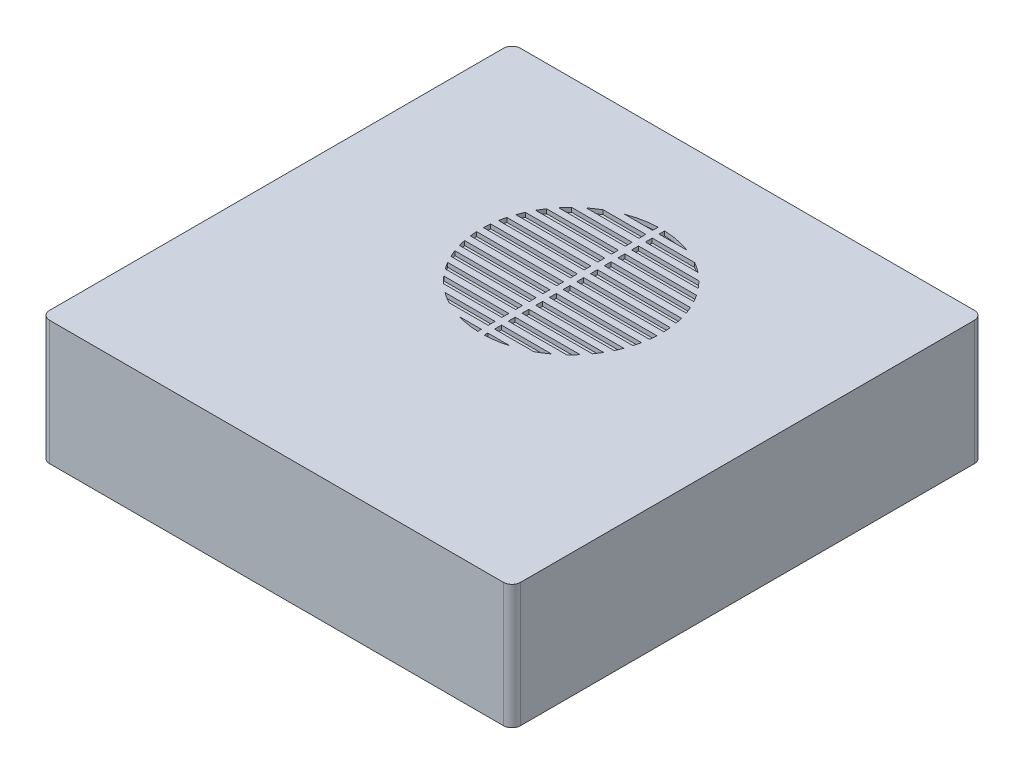
from build123d import *

# Parameters (mm, degrees)
SKETCH_1_W          = 110
SKETCH_1_H          = 110
EXTRUDE_1_DEPTH     = 29
CUT_EXTRUDE_1_DEPTH = 7
SKETCH_3_W          = 53.883979218
SKETCH_3_H          = 56.07244117
CUT_EXTRUDE_3_DEPTH = 6
SKETCH_4_W          = 10.323301276
SKETCH_4_H          = 3.598949069
SKETCH_4_W_2        = 10.796847207
SKETCH_4_W_3        = 11.270393137
SKETCH_4_W_4        = 49.154067547
SKETCH_4_H_2        = 7.671444068
CUT_EXTRUDE_4_DEPTH = 10
FILLET_1_R          = 2


with BuildPart() as part:
    # 草图1 → 凸台-拉伸1 (new body)
    with BuildSketch(Plane(origin=(0, 0, 0), x_dir=(1, 0, 0), z_dir=(0, 1, 0))):
        Rectangle(SKETCH_1_W, SKETCH_1_H)
    extrude(amount=EXTRUDE_1_DEPTH)

    # 草图2 → 切除-拉伸1 (cut)
    with BuildSketch(Plane(origin=(0, 29, 0), x_dir=(1, 0, 0), z_dir=(0, 1, 0))):
        with BuildLine():
            Line((-0.751901528, 34.886318516), (-0.751901528, 33.59149031))
            Line((-0.751901528, 33.59149031), (-7.310776634, 33.59149031))
            ThreePointArc((-7.310776634, 33.59149031), (-4.082993976, 34.500559204), (-0.751901528, 34.886318516))
        make_face()
        with BuildLine():
            Line((-0.751901528, 31.99149031), (-0.751901528, 30.39149031))
            Line((-0.751901528, 30.39149031), (-13.029015886, 30.39149031))
            ThreePointArc((-13.029015886, 30.39149031), (-11.883781834, 31.230990299), (-10.684631719, 31.99149031))
            Line((-10.684631719, 31.99149031), (-0.751901528, 31.99149031))
        make_face()
        with BuildLine():
            Line((0.751901528, 34.886318516), (0.751901528, 33.59149031))
            Line((0.751901528, 33.59149031), (7.310776634, 33.59149031))
            ThreePointArc((7.310776634, 33.59149031), (4.082993976, 34.500559204), (0.751901528, 34.886318516))
        make_face()
        with BuildLine():
            Line((-14.840119775, 28.79149031), (-0.751901528, 28.79149031))
            Line((-0.751901528, 28.79149031), (-0.751901528, 27.19149031))
            Line((-0.751901528, 27.19149031), (-16.296719146, 27.19149031))
            ThreePointArc((-16.296719146, 27.19149031), (-15.588960341, 28.010190206), (-14.840119775, 28.79149031))
        make_face()
        with BuildLine():
            Line((-17.487622906, 25.59149031), (-0.751901528, 25.59149031))
            Line((-0.751901528, 25.59149031), (-0.751901528, 23.99149031))
            Line((-0.751901528, 23.99149031), (-18.464313009, 23.99149031))
            ThreePointArc((-18.464313009, 23.99149031), (-17.993760697, 24.802351555), (-17.487622906, 25.59149031))
        make_face()
        with BuildLine():
            Line((-19.259406919, 22.39149031), (-0.751901528, 22.39149031))
            Line((-0.751901528, 22.39149031), (-0.751901528, 20.79149031))
            Line((-0.751901528, 20.79149031), (-19.894689112, 20.79149031))
            ThreePointArc((-19.894689112, 20.79149031), (-19.593386869, 21.597977674), (-19.259406919, 22.39149031))
        make_face()
        with BuildLine():
            Line((-20.385106201, 19.19149031), (-0.751901528, 19.19149031))
            Line((-0.751901528, 19.19149031), (-0.751901528, 17.59149031))
            Line((-0.751901528, 17.59149031), (-20.740936691, 17.59149031))
            ThreePointArc((-20.740936691, 17.59149031), (-20.578577477, 18.394949879), (-20.385106201, 19.19149031))
        make_face()
        with BuildLine():
            Line((-20.969033235, 15.99149031), (-0.751901528, 15.99149031))
            Line((-0.751901528, 15.99149031), (-0.751901528, 14.39149031))
            Line((-0.751901528, 14.39149031), (-21.073543954, 14.39149031))
            ThreePointArc((-21.073543954, 14.39149031), (-21.03650575, 15.192484283), (-20.969033235, 15.99149031))
        make_face()
        with BuildLine():
            Line((-21.056309144, 12.79149031), (-0.751901528, 12.79149031))
            Line((-0.751901528, 12.79149031), (-0.751901528, 11.19149031))
            Line((-0.751901528, 11.19149031), (-20.917027866, 11.19149031))
            ThreePointArc((-20.917027866, 11.19149031), (-21.001910745, 11.990163461), (-21.056309144, 12.79149031))
        make_face()
        with BuildLine():
            Line((-20.653231097, 9.59149031), (-0.751901528, 9.59149031))
            Line((-0.751901528, 9.59149031), (-0.751901528, 7.99149031))
            Line((-0.751901528, 7.99149031), (-20.260055644, 7.99149031))
            ThreePointArc((-20.260055644, 7.99149031), (-20.472280234, 8.787647791), (-20.653231097, 9.59149031))
        make_face()
        with BuildLine():
            Line((-19.729768237, 6.39149031), (-0.751901528, 6.39149031))
            Line((-0.751901528, 6.39149031), (-0.751901528, 4.79149031))
            Line((-0.751901528, 4.79149031), (-19.050922672, 4.79149031))
            ThreePointArc((-19.050922672, 4.79149031), (-19.406841496, 5.584491395), (-19.729768237, 6.39149031))
        make_face()
        with BuildLine():
            Line((-18.206909531, 3.19149031), (-0.751901528, 3.19149031))
            Line((-0.751901528, 3.19149031), (-0.751901528, 1.59149031))
            Line((-0.751901528, 1.59149031), (-17.173393801, 1.59149031))
            ThreePointArc((-17.173393801, 1.59149031), (-17.708231587, 2.379811633), (-18.206909531, 3.19149031))
        make_face()
        with BuildLine():
            Line((-15.91349599, -0.00850969), (-0.751901528, -0.00850969))
            Line((-0.751901528, -0.00850969), (-0.751901528, -1.60850969))
            Line((-0.751901528, -1.60850969), (-14.367785306, -1.60850969))
            ThreePointArc((-14.367785306, -1.60850969), (-15.161761086, -0.828913494), (-15.91349599, -0.00850969))
        make_face()
        with BuildLine():
            Line((-12.430090691, -3.20850969), (-0.751901528, -3.20850969))
            Line((-0.751901528, -3.20850969), (-0.751901528, -4.80850969))
            Line((-0.751901528, -4.80850969), (-9.872236553, -4.80850969))
            ThreePointArc((-9.872236553, -4.80850969), (-11.17982335, -4.054326816), (-12.430090691, -3.20850969))
        make_face()
        with BuildLine():
            Line((-5.940955693, -6.40850969), (-0.751901528, -6.40850969))
            Line((-0.751901528, -6.40850969), (-0.751901528, -7.249525385))
            ThreePointArc((-0.751901528, -7.249525385), (-3.372745364, -6.991391514), (-5.940955693, -6.40850969))
        make_face()
        with BuildLine():
            Line((0.751901528, 31.99149031), (0.751901528, 30.39149031))
            Line((0.751901528, 30.39149031), (13.029015886, 30.39149031))
            ThreePointArc((13.029015886, 30.39149031), (11.883781834, 31.230990299), (10.684631719, 31.99149031))
            Line((10.684631719, 31.99149031), (0.751901528, 31.99149031))
        make_face()
        with BuildLine():
            Line((0.751901528, 28.79149031), (0.751901528, 27.19149031))
            Line((0.751901528, 27.19149031), (16.296719146, 27.19149031))
            ThreePointArc((16.296719146, 27.19149031), (15.588960341, 28.010190206), (14.840119775, 28.79149031))
            Line((14.840119775, 28.79149031), (0.751901528, 28.79149031))
        make_face()
        with BuildLine():
            Line((0.751901528, 25.59149031), (17.487622906, 25.59149031))
            ThreePointArc((17.487622906, 25.59149031), (17.993760697, 24.802351555), (18.464313009, 23.99149031))
            Line((18.464313009, 23.99149031), (0.751901528, 23.99149031))
            Line((0.751901528, 23.99149031), (0.751901528, 25.59149031))
        make_face()
        with BuildLine():
            Line((0.751901528, 22.39149031), (19.259406919, 22.39149031))
            ThreePointArc((19.259406919, 22.39149031), (19.593386869, 21.597977674), (19.894689112, 20.79149031))
            Line((19.894689112, 20.79149031), (0.751901528, 20.79149031))
            Line((0.751901528, 20.79149031), (0.751901528, 22.39149031))
        make_face()
        with BuildLine():
            Line((0.751901528, 19.19149031), (20.385106201, 19.19149031))
            ThreePointArc((20.385106201, 19.19149031), (20.578577477, 18.394949879), (20.740936691, 17.59149031))
            Line((20.740936691, 17.59149031), (0.751901528, 17.59149031))
            Line((0.751901528, 17.59149031), (0.751901528, 19.19149031))
        make_face()
        with BuildLine():
            Line((0.751901528, 15.99149031), (20.969033235, 15.99149031))
            ThreePointArc((20.969033235, 15.99149031), (21.03650575, 15.192484283), (21.073543954, 14.39149031))
            Line((21.073543954, 14.39149031), (0.751901528, 14.39149031))
            Line((0.751901528, 14.39149031), (0.751901528, 15.99149031))
        make_face()
        with BuildLine():
            Line((0.751901528, 12.79149031), (21.056309144, 12.79149031))
            ThreePointArc((21.056309144, 12.79149031), (21.001910745, 11.990163461), (20.917027866, 11.19149031))
            Line((20.917027866, 11.19149031), (0.751901528, 11.19149031))
            Line((0.751901528, 11.19149031), (0.751901528, 12.79149031))
        make_face()
        with BuildLine():
            Line((0.751901528, 9.59149031), (20.653231097, 9.59149031))
            ThreePointArc((20.653231097, 9.59149031), (20.472280234, 8.787647791), (20.260055644, 7.99149031))
            Line((20.260055644, 7.99149031), (0.751901528, 7.99149031))
            Line((0.751901528, 7.99149031), (0.751901528, 9.59149031))
        make_face()
        with BuildLine():
            Line((0.751901528, 6.39149031), (19.729768237, 6.39149031))
            ThreePointArc((19.729768237, 6.39149031), (19.406841496, 5.584491395), (19.050922672, 4.79149031))
            Line((19.050922672, 4.79149031), (0.751901528, 4.79149031))
            Line((0.751901528, 4.79149031), (0.751901528, 6.39149031))
        make_face()
        with BuildLine():
            Line((0.751901528, 3.19149031), (18.206909531, 3.19149031))
            ThreePointArc((18.206909531, 3.19149031), (17.708231587, 2.379811633), (17.173393801, 1.59149031))
            Line((17.173393801, 1.59149031), (0.751901528, 1.59149031))
            Line((0.751901528, 1.59149031), (0.751901528, 3.19149031))
        make_face()
        with BuildLine():
            Line((0.751901528, -0.00850969), (15.91349599, -0.00850969))
            ThreePointArc((15.91349599, -0.00850969), (15.161761086, -0.828913494), (14.367785306, -1.60850969))
            Line((14.367785306, -1.60850969), (0.751901528, -1.60850969))
            Line((0.751901528, -1.60850969), (0.751901528, -0.00850969))
        make_face()
        with BuildLine():
            Line((0.751901528, -3.20850969), (12.430090691, -3.20850969))
            ThreePointArc((12.430090691, -3.20850969), (11.17982335, -4.054326816), (9.872236553, -4.80850969))
            Line((9.872236553, -4.80850969), (0.751901528, -4.80850969))
            Line((0.751901528, -4.80850969), (0.751901528, -3.20850969))
        make_face()
        with BuildLine():
            Line((0.751901528, -6.40850969), (5.940955693, -6.40850969))
            ThreePointArc((5.940955693, -6.40850969), (3.372745364, -6.991391514), (0.751901528, -7.249525385))
            Line((0.751901528, -7.249525385), (0.751901528, -6.40850969))
        make_face()
    extrude(amount=-CUT_EXTRUDE_1_DEPTH, mode=Mode.SUBTRACT)

    # 草图3 → 切除-拉伸3 (cut)
    with BuildSketch(Plane(origin=(0, 22, 0), x_dir=(1, 0, 0), z_dir=(0, 1, 0))):
        with Locations((-2.446069618, 15.99149031)):
            Rectangle(SKETCH_3_W, SKETCH_3_H)
    extrude(amount=CUT_EXTRUDE_3_DEPTH, mode=Mode.SUBTRACT)

    # 草图4 → 切除-拉伸4 (cut)
    with BuildSketch(Plane(origin=(0, 0, -55), x_dir=(-1, 0, 0), z_dir=(0, 0, -1))):
        with Locations((-43.710945988, 6.201665953)):
            Rectangle(SKETCH_4_W, SKETCH_4_H)
        with Locations((-27.657738957, 6.201665953)):
            Rectangle(SKETCH_4_W_2, SKETCH_4_H)
        with Locations((-11.888659484, 6.201665953)):
            Rectangle(SKETCH_4_W_3, SKETCH_4_H)
        with Locations((24.47966795, 8.237913452)):
            Rectangle(SKETCH_4_W_4, SKETCH_4_H_2)
    extrude(amount=-CUT_EXTRUDE_4_DEPTH, mode=Mode.SUBTRACT)

    # 圆角1
    fillet_1_edges = [part.edges().sort_by_distance(p)[0] for p in [
        (-55, 14.5, -55),
        (55, 14.5, -55),
        (55, 14.5, 55),
        (-55, 14.5, 55),
    ]]
    fillet(fillet_1_edges, radius=FILLET_1_R)


solid = part.part
